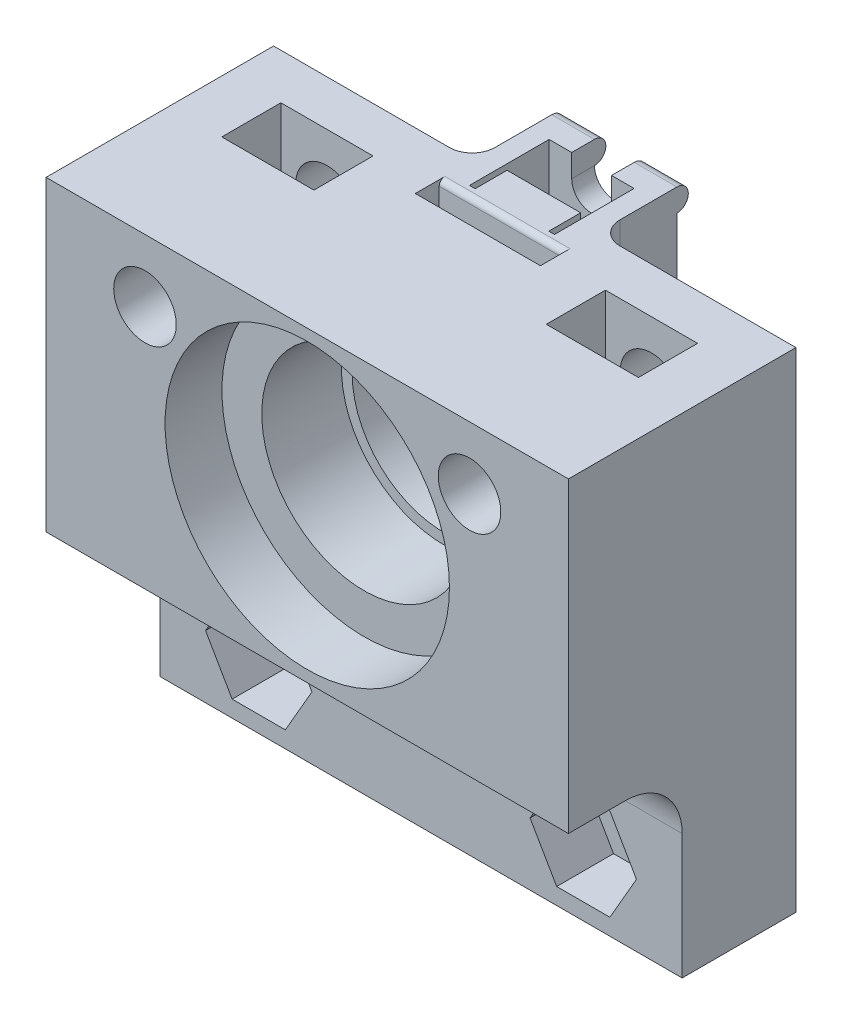
from build123d import *

# Parameters (mm, degrees)
BOSS_EXTRUDE1_DEPTH      = 13.5
BOSS_EXTRUDE2_DEPTH      = 18.5
BOSS_EXTRUDE3_DEPTH      = 5
SKETCH4_W                = 45.922011884
SKETCH4_H                = 20
BOSS_EXTRUDE4_DEPTH      = 13.5
SKETCH2_R                = 4.25
CUT_EXTRUDE1_DEPTH       = 268.629329099
SKETCH6_R                = 9
CUT_EXTRUDE3_DEPTH       = 12
SKETCH7_R                = 12.5
CUT_EXTRUDE4_DEPTH       = 5
BOSS_EXTRUDE5_DEPTH      = 13.5
CUT_EXTRUDE5_REACH       = 210.1
SKETCH8_R                = 9
CUT_EXTRUDE6_REACH       = 210.1
SKETCH10_R               = 4
SKETCH11_R               = 8
CUT_EXTRUDE7_DEPTH       = 4
SKETCH18_R               = 11
CUT_EXTRUDE9_DEPTH       = 47
CUT_EXTRUDE11_DEPTH      = 268.629329099
CUT_EXTRUDE11_DEPTH_BACK = 268.629329099
SKETCH20_W               = 45.922011884
SKETCH20_H               = 204.425421037
SKETCH21_W               = 45.922011884
SKETCH21_H               = 10
BOSS_EXTRUDE6_DEPTH      = 16
M5_CLEARANCE_HOLE1_D     = 5.5
CUT_EXTRUDE12_DEPTH      = 5
FILLET1_R                = 5
LPATTERN2_COPY_1_D       = 5.5
LPATTERN2_COPY_2_D       = 5.5
CUT_EXTRUDE13_START      = -9.2
SKETCH25_R               = 2.75
CUT_EXTRUDE13_DEPTH      = 5.2
SKETCH26_R               = 8.05
CUT_EXTRUDE14_DEPTH      = 4
SKETCH27_W               = 11
SKETCH27_H               = 7
BOSS_EXTRUDE7_DEPTH      = 5
CUT_EXTRUDE15_DEPTH      = 5
FILLET2_R                = 2
BOSS_EXTRUDE8_DEPTH      = 2
BOSS_EXTRUDE9_DEPTH      = 3.75
SKETCH31_W               = 11
SKETCH31_H               = 2.1
CUT_EXTRUDE16_DEPTH      = 2.5
FILLET3_R                = 0.5
CUT_EXTRUDE17_REACH      = 44.396
SKETCH32_R               = 4.5


with BuildPart() as part:
    # Sketch1 → Boss-Extrude1 (new, symmetric)
    with BuildSketch(Plane(origin=(0, 0, 0), x_dir=(1, 0, 0), z_dir=(0, 1, 0))):
        with BuildLine():
            ThreePointArc((17.220754456, -41.574578963), (0, -45), (-17.220754456, -41.574578963))
            Line((-17.220754456, -41.574578963), (-22.961005942, -55.432771951))
            ThreePointArc((-22.961005942, -55.432771951), (0, -60), (22.961005942, -55.432771951))
            Line((22.961005942, -55.432771951), (17.220754456, -41.574578963))
        make_face()
    extrude(amount=BOSS_EXTRUDE1_DEPTH, both=True)

    # Sketch1<3> → Boss-Extrude2 (add, symmetric)
    with BuildSketch(Plane(origin=(0, 0, 0), x_dir=(1, 0, 0), z_dir=(0, 1, 0))):
        with BuildLine():
            ThreePointArc((19.134171618, -46.193976626), (0, -50), (-19.134171618, -46.193976626))
            Line((-19.134171618, -46.193976626), (-21.04758878, -50.813374288))
            ThreePointArc((-21.04758878, -50.813374288), (0, -55), (21.04758878, -50.813374288))
            Line((21.04758878, -50.813374288), (19.134171618, -46.193976626))
        make_face()
    extrude(amount=BOSS_EXTRUDE2_DEPTH, both=True)

    # Sketch3 → Boss-Extrude3 (add, symmetric)
    with BuildSketch(Plane.XZ):
        with BuildLine():
            Line((-22.961005942, 266), (-22.961005942, 55.432771951))
            ThreePointArc((-22.961005942, 55.432771951), (-20.481139434, 56.39612511), (-17.961005942, 57.248600555))
            Line((-17.961005942, 57.248600555), (-17.961005942, 246))
            Line((-17.961005942, 246), (17.961005942, 246))
            Line((17.961005942, 246), (17.961005942, 57.248600555))
            ThreePointArc((17.961005942, 57.248600555), (20.481139434, 56.39612511), (22.961005942, 55.432771951))
            Line((22.961005942, 55.432771951), (22.961005942, 266))
            Line((22.961005942, 266), (-22.961005942, 266))
        make_face()
    extrude(amount=BOSS_EXTRUDE3_DEPTH, both=True)

    # Sketch4 → Boss-Extrude4 (add, symmetric)
    with BuildSketch(Plane(origin=(0, 0, 0), x_dir=(1, 0, 0), z_dir=(0, 1, 0))):
        with Locations((0, -256)):
            Rectangle(SKETCH4_W, SKETCH4_H)
    extrude(amount=BOSS_EXTRUDE4_DEPTH, both=True)

    # Sketch2 → Cut-Extrude1 (cut, through all)
    with BuildSketch(Plane.XY):
        Circle(SKETCH2_R)
    extrude(amount=CUT_EXTRUDE1_DEPTH, mode=Mode.SUBTRACT)

    # Sketch6 → Cut-Extrude3 (cut)
    with BuildSketch(Plane.XY.offset(266)):
        Circle(SKETCH6_R)
    extrude(amount=-CUT_EXTRUDE3_DEPTH, mode=Mode.SUBTRACT)

    # Sketch7 → Cut-Extrude4 (cut)
    with BuildSketch(Plane.XY.offset(266)):
        Circle(SKETCH7_R)
    extrude(amount=-CUT_EXTRUDE4_DEPTH, mode=Mode.SUBTRACT)

    # Sketch9 → Boss-Extrude5 (add, symmetric)
    with BuildSketch(Plane(origin=(0, 0, 0), x_dir=(1, 0, 0), z_dir=(0, 1, 0))):
        with BuildLine():
            Line((-22.961005942, -55.432771951), (-22.961005942, -68))
            Line((-22.961005942, -68), (22.961005942, -68))
            Line((22.961005942, -68), (22.961005942, -55.432771951))
            ThreePointArc((22.961005942, -55.432771951), (0, -60), (-22.961005942, -55.432771951))
        make_face()
    extrude(amount=BOSS_EXTRUDE5_DEPTH, both=True)

    # Sketch8 → Cut-Extrude5 (cut, up to next)
    with BuildSketch(Plane.XY.offset(60), mode=Mode.PRIVATE) as cut_extrude5_sk1:
        Circle(SKETCH8_R)
    cut_extrude5_tool1 = extrude(cut_extrude5_sk1.sketch, amount=-CUT_EXTRUDE5_REACH, mode=Mode.PRIVATE) & part.part
    add(cut_extrude5_tool1.solids().sort_by_distance((0, 0, 60))[0], mode=Mode.SUBTRACT)

    # Sketch10 → Cut-Extrude6 (cut, up to next)
    with BuildSketch(Plane.XY.offset(60), mode=Mode.PRIVATE) as cut_extrude6_sk1:
        Circle(SKETCH10_R)
    cut_extrude6_tool1 = extrude(cut_extrude6_sk1.sketch, amount=CUT_EXTRUDE6_REACH, mode=Mode.PRIVATE) & part.part
    add(cut_extrude6_tool1.solids().sort_by_distance((0, 0, 60))[0], mode=Mode.SUBTRACT)

    # Sketch11 → Cut-Extrude7 (cut)
    with BuildSketch(Plane.XY.offset(68)):
        Circle(SKETCH11_R)
    extrude(amount=-CUT_EXTRUDE7_DEPTH, mode=Mode.SUBTRACT)

    # Sketch18 → Cut-Extrude9 (cut)
    with BuildSketch(Plane.XY):
        Circle(SKETCH18_R)
    extrude(amount=CUT_EXTRUDE9_DEPTH, mode=Mode.SUBTRACT)

    # Sketch20 → Cut-Extrude11 (cut, two sides: drawn at the far end of the back side and taken through both)
    with BuildSketch(Plane(origin=(0, 0, 0), x_dir=(1, 0, 0), z_dir=(0, 1, 0)).offset(-CUT_EXTRUDE11_DEPTH_BACK)):
        with Locations((0, -143.787289482)):
            Rectangle(SKETCH20_W, SKETCH20_H)
    extrude(amount=CUT_EXTRUDE11_DEPTH + CUT_EXTRUDE11_DEPTH_BACK, mode=Mode.SUBTRACT)

    # Sketch21 → Boss-Extrude6 (add)
    with BuildSketch(Plane.XZ.offset(13.5)):
        with Locations((0, 251)):
            Rectangle(SKETCH21_W, SKETCH21_H)
    extrude(amount=BOSS_EXTRUDE6_DEPTH)

    # M5 Clearance Hole1 (through all)
    with Locations(Plane(origin=(0, 0, 246), x_dir=(-1, 0, 0), z_dir=(0, 0, -1))):
        with Locations((-14.26606865, -24)):
            m5_clearance_hole1 = Hole(M5_CLEARANCE_HOLE1_D / 2)

    # Sketch24 → Cut-Extrude12 (cut)
    with BuildSketch(Plane.XY.offset(256)):
        Polygon((18.94260583, -24), (16.60433724, -19.95), (11.92780006, -19.95), (9.58953147, -24), (11.92780006, -28.05), (16.60433724, -28.05), align=None)
    cut_extrude12 = extrude(amount=-CUT_EXTRUDE12_DEPTH, mode=Mode.SUBTRACT)

    # Mirror1: M5 Clearance Hole1 across plane
    add(m5_clearance_hole1.mirror(Plane(origin=(0, 0, 0), x_dir=(0, 0, 1), z_dir=(1, 0, 0))), mode=Mode.SUBTRACT)

    # Mirror2: Cut-Extrude12 across plane
    add(cut_extrude12.mirror(Plane(origin=(0, 0, 0), x_dir=(0, 0, 1), z_dir=(1, 0, 0))), mode=Mode.SUBTRACT)

    # Fillet1
    fillet1_edges = [part.edges().sort_by_distance(p)[0] for p in [
        (0, -13.5, 256),
    ]]
    fillet(fillet1_edges, radius=FILLET1_R)

    # LPattern2 copy 1 (through all)
    with Locations(Plane(origin=(0, 32, 246), x_dir=(1, 0, 0), z_dir=(0, 0, -1))):
        with Locations((-14.26606865, 24)):
            Hole(LPATTERN2_COPY_1_D / 2)

    # LPattern2 copy 2 (through all)
    with Locations(Plane(origin=(0, 32, 246), x_dir=(-1, 0, 0), z_dir=(0, 0, -1))):
        with Locations((-14.26606865, -24)):
            Hole(LPATTERN2_COPY_2_D / 2)

    # Sketch25 → Cut-Extrude13 (cut)
    with BuildSketch(Plane(origin=(0, 0, 246), x_dir=(-1, 0, 0), z_dir=(0, 0, -1)).offset(CUT_EXTRUDE13_START)):
        Polygon((-10.21606865, 5.66173141), (-10.21606865, 13.5), (-18.31606865, 13.5), (-18.31606865, 5.66173141), (-14.26606865, 3.32346282), align=None)
        with Locations((-14.26606865, 8)):
            Circle(SKETCH25_R, mode=Mode.SUBTRACT)
    cut_extrude13 = extrude(amount=CUT_EXTRUDE13_DEPTH, mode=Mode.SUBTRACT)

    # Mirror3: Cut-Extrude13 across plane
    add(cut_extrude13.mirror(Plane(origin=(0, 0, 0), x_dir=(0, 0, 1), z_dir=(1, 0, 0))), mode=Mode.SUBTRACT)

    # Sketch26 → Cut-Extrude14 (cut)
    with BuildSketch(Plane.XY.offset(254)):
        Circle(SKETCH26_R)
    extrude(amount=-CUT_EXTRUDE14_DEPTH, mode=Mode.SUBTRACT)

    # Sketch27 → Boss-Extrude7 (add)
    with BuildSketch(Plane(origin=(0, 0, 246), x_dir=(-1, 0, 0), z_dir=(0, 0, -1))):
        with Locations((0, 10)):
            Rectangle(SKETCH27_W, SKETCH27_H)
    extrude(amount=BOSS_EXTRUDE7_DEPTH)

    # Sketch28 → Cut-Extrude15 (cut)
    with BuildSketch(Plane(origin=(0, 13.5, 0), x_dir=(1, 0, 0), z_dir=(0, 1, 0))):
        Polygon((-3.735, -241), (3.735, -241), (3.735, -248), (3.235, -248), (3.235, -245.2), (-3.235, -245.2), (-3.235, -248), (-3.735, -248), align=None)
    extrude(amount=-CUT_EXTRUDE15_DEPTH, mode=Mode.SUBTRACT)

    # Fillet2
    fillet2_edges = [part.edges().sort_by_distance(p)[0] for p in [
        (0, 6.5, 246),
        (5.5, 10, 246),
        (-5.5, 10, 246),
    ]]
    fillet(fillet2_edges, radius=FILLET2_R)

    # Sketch29 → Boss-Extrude8 (add)
    with BuildSketch(Plane(origin=(0, 0, 241), x_dir=(-1, 0, 0), z_dir=(0, 0, -1))):
        with BuildLine():
            ThreePointArc((1.75, 11.5), (0, 9.75), (-1.75, 11.5))
            Line((-1.75, 11.5), (-1.75, 13.5))
            Line((-1.75, 13.5), (-5.5, 13.5))
            Line((-5.5, 13.5), (-5.5, 6.5))
            Line((-5.5, 6.5), (5.5, 6.5))
            Line((5.5, 6.5), (5.5, 13.5))
            Line((5.5, 13.5), (1.75, 13.5))
            Line((1.75, 13.5), (1.75, 11.5))
        make_face()
    extrude(amount=BOSS_EXTRUDE8_DEPTH)

    # Sketch30 → Boss-Extrude9 (add)
    with BuildSketch(Plane.ZY.offset(5.5)):
        with BuildLine():
            Line((239, 11.5), (239, 13.5))
            ThreePointArc((239, 13.5), (238, 12.5), (239, 11.5))
        make_face()
    boss_extrude9 = extrude(amount=-BOSS_EXTRUDE9_DEPTH)

    # Mirror4: Boss-Extrude9 across plane
    add(boss_extrude9.mirror(Plane(origin=(0, 0, 0), x_dir=(0, 0, 1), z_dir=(1, 0, 0))))

    # Sketch31 → Cut-Extrude16 (cut)
    with BuildSketch(Plane(origin=(0, 13.5, 0), x_dir=(1, 0, 0), z_dir=(0, 1, 0))):
        with Locations((0, -249.95)):
            Rectangle(SKETCH31_W, SKETCH31_H)
    extrude(amount=-CUT_EXTRUDE16_DEPTH, mode=Mode.SUBTRACT)

    # Fillet3
    fillet3_edges = [part.edges().sort_by_distance(p)[0] for p in [
        (0, 13.5, 248.9),
    ]]
    fillet(fillet3_edges, radius=FILLET3_R)

    # Sketch32 → Cut-Extrude17 (cut, up to next)
    with BuildSketch(Plane(origin=(0, 0, 246), x_dir=(-1, 0, 0), z_dir=(0, 0, -1)), mode=Mode.PRIVATE) as cut_extrude17_sk1:
        Circle(SKETCH32_R)
    cut_extrude17_tool1 = extrude(cut_extrude17_sk1.sketch, amount=-CUT_EXTRUDE17_REACH, mode=Mode.PRIVATE) & part.part
    add(cut_extrude17_tool1.solids().sort_by_distance((0, 0, 246))[0], mode=Mode.SUBTRACT)


solid = part.part
